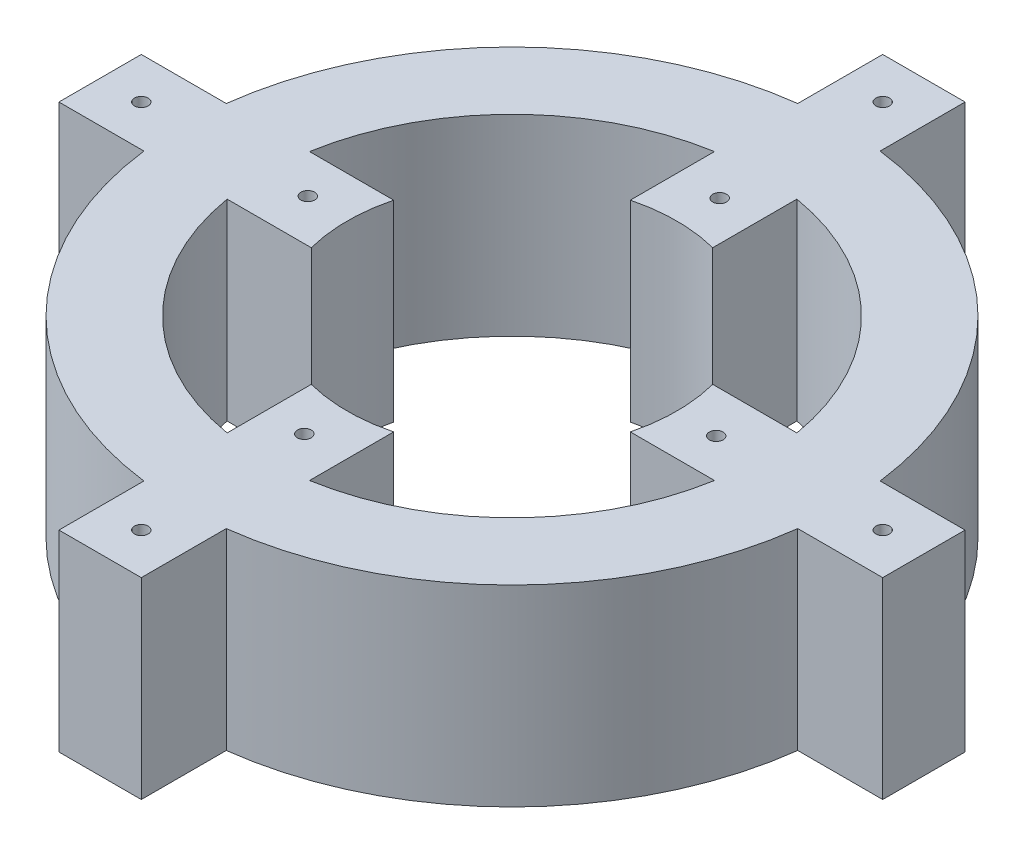
from build123d import *

# Parameters (mm, degrees)
SKETCH_1_R      = 3.175
EXTRUDE_1_DEPTH = 88.9


with BuildPart() as part:
    # Эскиз1 → Бобышка-Вытянуть1 (new body)
    with BuildSketch(Plane(origin=(0, 0, 0), x_dir=(1, 0, 0), z_dir=(0, 1, 0))):
        with BuildLine():
            Line((-194.590147989, 18.24646839), (-194.590147989, -19.85353161))
            Line((-194.590147989, -19.85353161), (-155.294835417, -19.85353161))
            ThreePointArc((-155.294835417, -19.85353161), (-140.960808265, -67.827276327), (-111.853221442, -108.566605063))
            ThreePointArc((-111.853221442, -108.566605063), (-71.113892706, -137.674191886), (-23.140147989, -152.008219038))
            Line((-23.140147989, -152.008219038), (-23.140147989, -191.30353161))
            Line((-23.140147989, -191.30353161), (14.959852011, -191.30353161))
            Line((14.959852011, -191.30353161), (14.959852011, -152.008219038))
            ThreePointArc((14.959852011, -152.008219038), (62.933596727, -137.674191886), (103.672925464, -108.566605063))
            ThreePointArc((103.672925464, -108.566605063), (132.780512286, -67.827276327), (147.114539438, -19.85353161))
            Line((147.114539438, -19.85353161), (186.409852011, -19.85353161))
            Line((186.409852011, -19.85353161), (186.409852011, 18.24646839))
            Line((186.409852011, 18.24646839), (147.114539438, 18.24646839))
            ThreePointArc((147.114539438, 18.24646839), (132.780512286, 66.220213106), (103.672925464, 106.959541842))
            ThreePointArc((103.672925464, 106.959541842), (62.933596727, 136.067128665), (14.959852011, 150.401155817))
            Line((14.959852011, 150.401155817), (14.959852011, 189.69646839))
            Line((14.959852011, 189.69646839), (-23.140147989, 189.69646839))
            Line((-23.140147989, 189.69646839), (-23.140147989, 150.401155817))
            ThreePointArc((-23.140147989, 150.401155817), (-71.113892706, 136.067128665), (-111.853221442, 106.959541842))
            ThreePointArc((-111.853221442, 106.959541842), (-140.960808265, 66.220213106), (-155.294835417, 18.24646839))
            Line((-155.294835417, 18.24646839), (-194.590147989, 18.24646839))
        make_face()
        with Locations(Location((-175.540147989, -0.80353161, 0), (0, 0, 270))):
            Circle(SKETCH_1_R, mode=Mode.SUBTRACT)
        with Locations(Location((-99.340147989, 0, 0), (0, 0, 90))):
            Circle(SKETCH_1_R, mode=Mode.SUBTRACT)
        with Locations(Location((-4.090147989, 170.64646839, 0), (0, 0, 270))):
            Circle(SKETCH_1_R, mode=Mode.SUBTRACT)
        with Locations(Location((-3.286616379, 94.44646839, 0), (0, 0, 90))):
            Circle(SKETCH_1_R, mode=Mode.SUBTRACT)
        with Locations(Location((167.359852011, -0.80353161, 0), (0, 0, 270))):
            Circle(SKETCH_1_R, mode=Mode.SUBTRACT)
        with Locations(Location((91.159852011, -1.607063221, 0), (0, 0, 90))):
            Circle(SKETCH_1_R, mode=Mode.SUBTRACT)
        with Locations(Location((-4.090147989, -172.25353161, 0), (0, 0, 270))):
            Circle(SKETCH_1_R, mode=Mode.SUBTRACT)
        with Locations(Location((-4.8936796, -96.05353161, 0), (0, 0, 90))):
            Circle(SKETCH_1_R, mode=Mode.SUBTRACT)
        with BuildLine():
            Line((-77.870480735, 18.24646839), (-116.791467857, 18.24646839))
            ThreePointArc((-116.791467857, 18.24646839), (-84.912453079, 80.018773479), (-23.140147989, 111.897788258))
            Line((-23.140147989, 111.897788258), (-23.140147989, 72.976801135))
            ThreePointArc((-23.140147989, 72.976801135), (-4.090147989, 75.39646839), (14.959852011, 72.976801135))
            Line((14.959852011, 72.976801135), (14.959852011, 111.897788258))
            ThreePointArc((14.959852011, 111.897788258), (76.7321571, 80.018773479), (108.611171879, 18.24646839))
            Line((108.611171879, 18.24646839), (69.690184756, 18.24646839))
            ThreePointArc((69.690184756, 18.24646839), (72.109852011, -0.80353161), (69.690184756, -19.85353161))
            Line((69.690184756, -19.85353161), (108.611171879, -19.85353161))
            ThreePointArc((108.611171879, -19.85353161), (76.7321571, -81.6258367), (14.959852011, -113.504851478))
            Line((14.959852011, -113.504851478), (14.959852011, -74.583864356))
            ThreePointArc((14.959852011, -74.583864356), (-4.090147989, -77.00353161), (-23.140147989, -74.583864356))
            Line((-23.140147989, -74.583864356), (-23.140147989, -113.504851478))
            ThreePointArc((-23.140147989, -113.504851478), (-84.912453079, -81.6258367), (-116.791467857, -19.85353161))
            Line((-116.791467857, -19.85353161), (-77.870480735, -19.85353161))
            ThreePointArc((-77.870480735, -19.85353161), (-80.290147989, -0.80353161), (-77.870480735, 18.24646839))
        make_face(mode=Mode.SUBTRACT)
    extrude(amount=EXTRUDE_1_DEPTH)


solid = part.part
